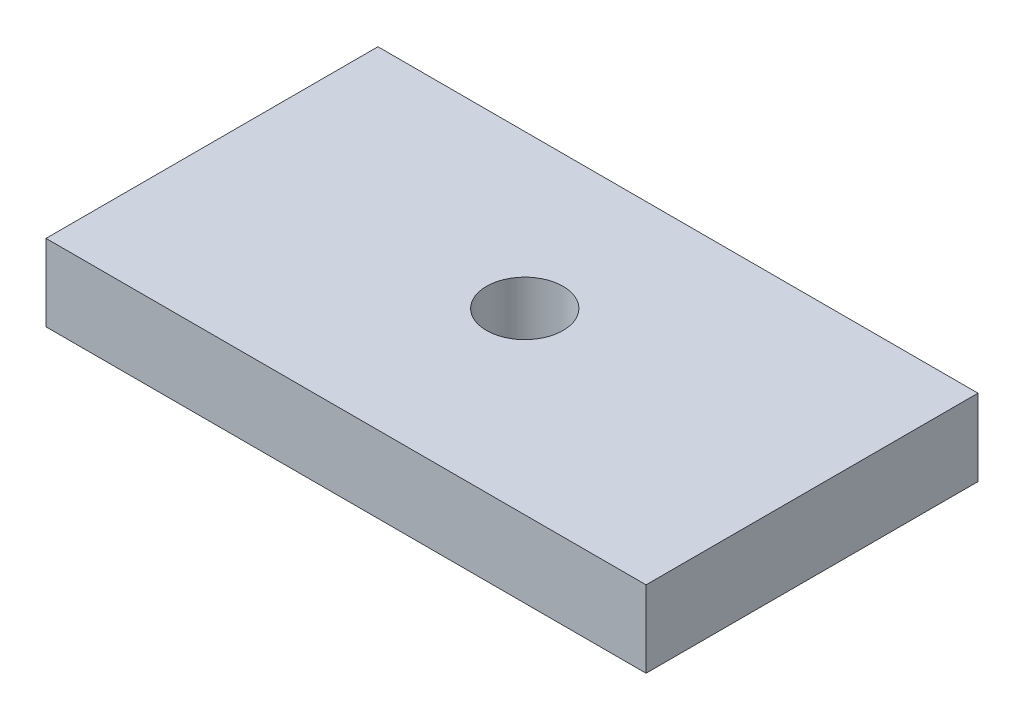
from build123d import *

# Parameters (mm, degrees)
RESSALTO_EXTRUS_O2_DEPTH = 13
ESBO_O3_R                = 1.5
CORTE_EXTRUS_O2_DEPTH    = 13


with BuildPart() as part:
    # Esboço1 → Ressalto-extrusão2 (new body)
    with BuildSketch(Plane.XY):
        Polygon((-7.457901998, 2.385917031), (-7.230517524, 2.385917031), (4.042098002, 2.385917031), (10.042098002, 2.385917031), (10.042098002, 5.385917031), (-13.457901998, 5.385917031), (-13.457901998, 2.385917031), align=None)
    extrude(amount=RESSALTO_EXTRUS_O2_DEPTH)

    # Esboço3 → Corte-extrusão2 (cut)
    with BuildSketch(Plane(origin=(0, 5.385917031, 0), x_dir=(1, 0, 0), z_dir=(0, 1, 0))):
        with Locations(Location((-1.707901998, -6, 0), (0, 0, 180))):
            Circle(ESBO_O3_R)
    extrude(amount=-CORTE_EXTRUS_O2_DEPTH, mode=Mode.SUBTRACT)


solid = part.part
